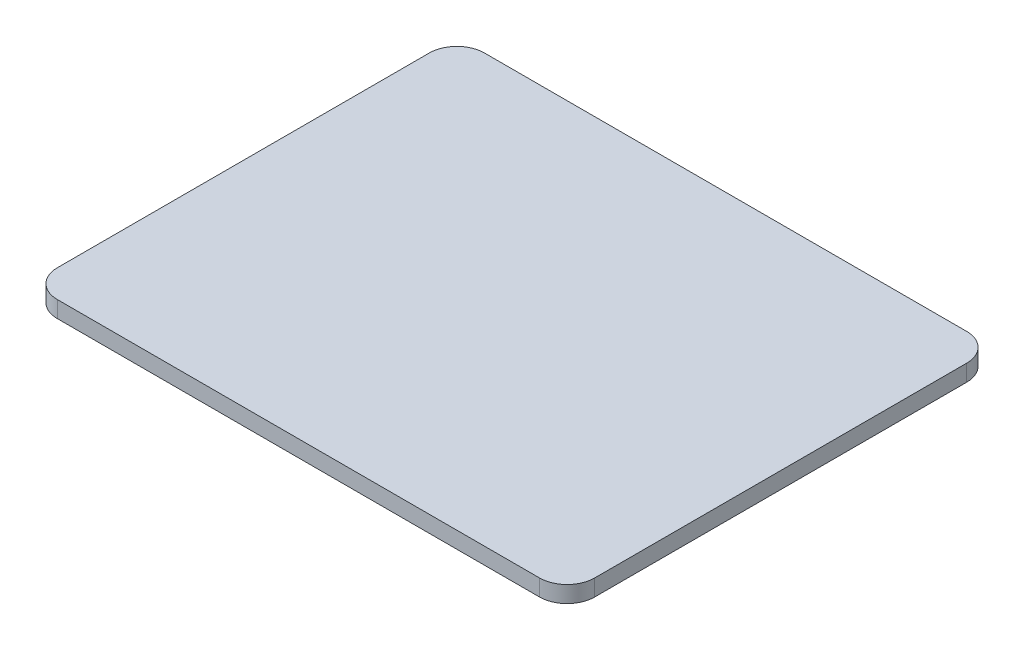
from build123d import *

# Parameters (mm, degrees)
SKETCH1_W           = 195
SKETCH1_H           = 155
BOSS_EXTRUDE1_DEPTH = 6
FILLET1_R           = 10


with BuildPart() as part:
    # Sketch1 → Boss-Extrude1 (new body)
    with BuildSketch(Plane(origin=(0, 0, 0), x_dir=(1, 0, 0), z_dir=(0, 1, 0))):
        Rectangle(SKETCH1_W, SKETCH1_H)
    extrude(amount=BOSS_EXTRUDE1_DEPTH)

    # Fillet1
    fillet1_edges = [part.edges().sort_by_distance(p)[0] for p in [
        (97.5, 3, 77.5),
        (-97.5, 3, 77.5),
        (-97.5, 3, -77.5),
        (97.5, 3, -77.5),
    ]]
    fillet(fillet1_edges, radius=FILLET1_R)


solid = part.part
